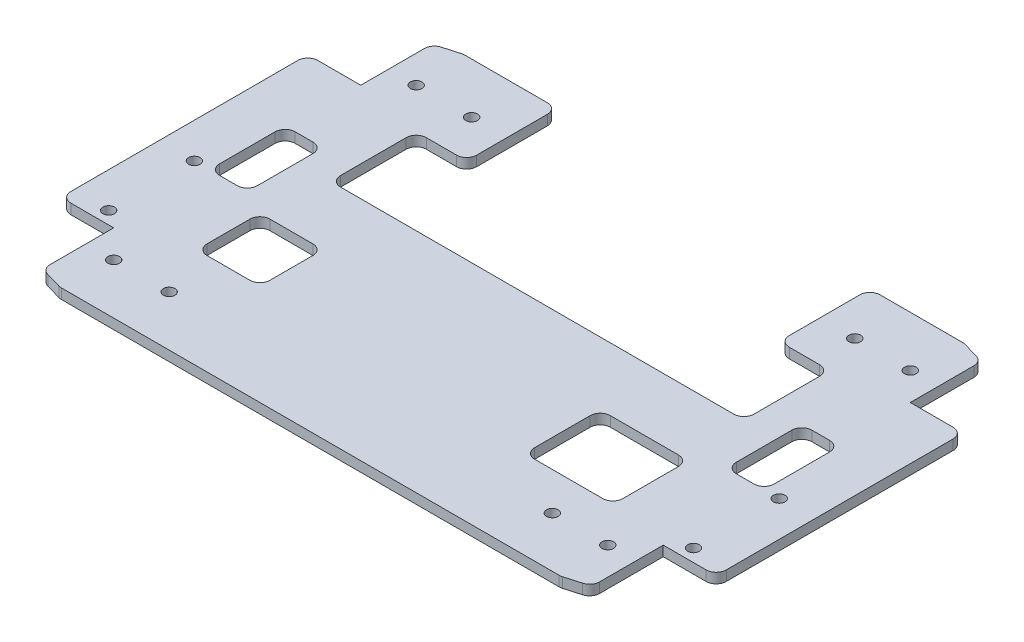
from build123d import *

# Parameters (mm, degrees)
BOSS_EXTRU_1_DEPTH       = 4
ENL_V_MAT_EXTRU_6_REACH  = 161.581
ESQUISSE15_R             = 2.3
ENL_V_MAT_EXTRU_10_REACH = 161.581
SYM_TRIE8_COPY_1_REACH   = 161.581
ENL_V_MAT_EXTRU_13_REACH = 161.581
ESQUISSE26_W             = 5
ESQUISSE26_H             = 98
ENL_V_MAT_EXTRU_14_REACH = 154.696
ESQUISSE27_R             = 2.3
ENL_V_MAT_EXTRU_15_REACH = 154.696
CONG_1_R                 = 4
ENL_V_MAT_EXTRU_16_REACH = 154.696
ESQUISSE29_W             = 35
ESQUISSE29_H             = 30
ESQUISSE29_W_2           = 15
ESQUISSE29_W_3           = 20
ESQUISSE29_H_2           = 34
ESQUISSE29_W_4           = 25
ESQUISSE29_H_3           = 25
CONG_2_R                 = 4
ENL_V_MAT_EXTRU_17_REACH = 154.696
ESQUISSE30_R             = 2.3
CONG_3_R                 = 4


with BuildPart() as part:
    # Esquisse1 → Boss.-Extru.1 (new body)
    with BuildSketch(Plane(origin=(0, 0, 0), x_dir=(1, 0, 0), z_dir=(0, 1, 0))):
        Polygon((-135, 0), (-135, -75), (-100, -85), (0, -85), (100, -85), (135, -75), (135, 0), (135, 75), (100, 85), (0, 85), (-100, 85), (-135, 75), align=None)
    extrude(amount=BOSS_EXTRU_1_DEPTH)

    # Esquisse15 → Enlèv. mat.-Extru.6 (cut, up to next)
    with BuildSketch(Plane(origin=(0, 4, 0), x_dir=(1, 0, 0), z_dir=(0, 1, 0)), mode=Mode.PRIVATE) as enl_v_mat_extru_6_sk1:
        with Locations(Location((-120, -60, 0), (0, 0, 270))):
            Circle(ESQUISSE15_R)
    enl_v_mat_extru_6_tool1 = extrude(enl_v_mat_extru_6_sk1.sketch, amount=-ENL_V_MAT_EXTRU_6_REACH, mode=Mode.PRIVATE) & part.part
    # Esquisse15 → Enlèv. mat.-Extru.6 (cut, up to next)
    with BuildSketch(Plane(origin=(0, 4, 0), x_dir=(1, 0, 0), z_dir=(0, 1, 0)), mode=Mode.PRIVATE) as enl_v_mat_extru_6_sk2:
        with Locations(Location((-120, 60, 0), (0, 0, 270))):
            Circle(ESQUISSE15_R)
    enl_v_mat_extru_6_tool2 = extrude(enl_v_mat_extru_6_sk2.sketch, amount=-ENL_V_MAT_EXTRU_6_REACH, mode=Mode.PRIVATE) & part.part
    enl_v_mat_extru_6_1 = enl_v_mat_extru_6_tool1.solids().sort_by_distance((-120, 4, 60))[0]
    add(enl_v_mat_extru_6_1, mode=Mode.SUBTRACT)
    enl_v_mat_extru_6_2 = enl_v_mat_extru_6_tool2.solids().sort_by_distance((-120, 4, -60))[0]
    add(enl_v_mat_extru_6_2, mode=Mode.SUBTRACT)
    enl_v_mat_extru_6 = enl_v_mat_extru_6_1 + enl_v_mat_extru_6_2  # Enlèv. mat.-Extru.6 as one shape, for the pattern or mirror that repeats it

    # Symétrie5: Enlèv. mat.-Extru.6 across plane
    add(enl_v_mat_extru_6.mirror(Plane(origin=(0, 0, 0), x_dir=(0, 0, 1), z_dir=(1, 0, 0))), mode=Mode.SUBTRACT)

    # Esquisse20 → Enlèv. mat.-Extru.10 (cut, up to next)
    with BuildSketch(Plane(origin=(0, 4, 0), x_dir=(1, 0, 0), z_dir=(0, 1, 0)), mode=Mode.PRIVATE) as enl_v_mat_extru_10_sk1:
        Polygon((-109, -60), (-109, -82.428571429), (-135, -75), (-135, -49), (-109, -49), align=None)
    enl_v_mat_extru_10_tool1 = extrude(enl_v_mat_extru_10_sk1.sketch, amount=-ENL_V_MAT_EXTRU_10_REACH, mode=Mode.PRIVATE) & part.part
    enl_v_mat_extru_10 = enl_v_mat_extru_10_tool1.solids().sort_by_distance((-121.458333, 4, 63.934524))[0]
    add(enl_v_mat_extru_10, mode=Mode.SUBTRACT)

    # Symétrie7: Enlèv. mat.-Extru.10 across plane
    add(enl_v_mat_extru_10.mirror(Plane(origin=(0, 0, 0), x_dir=(0, 0, 1), z_dir=(1, 0, 0))), mode=Mode.SUBTRACT)

    # Symétrie8: Enlèv. mat.-Extru.10 across plane
    add(enl_v_mat_extru_10.mirror(Plane.XY), mode=Mode.SUBTRACT)

    # Symétrie8 copy 1 sketch → Symétrie8 copy 1 (cut, up to next)
    with BuildSketch(Plane(origin=(0, 4, 0), x_dir=(-1, 0, 0), z_dir=(0, 1, 0)), mode=Mode.PRIVATE) as sym_trie8_copy_1_sk1:
        Polygon((-109, -60), (-109, -82.428571429), (-135, -75), (-135, -49), (-109, -49), align=None)
    sym_trie8_copy_1_tool1 = extrude(sym_trie8_copy_1_sk1.sketch, amount=-SYM_TRIE8_COPY_1_REACH, mode=Mode.PRIVATE) & part.part
    add(sym_trie8_copy_1_tool1.solids().sort_by_distance((121.458333, 4, -63.934524))[0], mode=Mode.SUBTRACT)

    # Esquisse26 → Enlèv. mat.-Extru.13 (cut, up to next)
    with BuildSketch(Plane(origin=(0, 4, 0), x_dir=(1, 0, 0), z_dir=(0, 1, 0)), mode=Mode.PRIVATE) as enl_v_mat_extru_13_sk1:
        Polygon((109, -82.428571429), (107.626394361, -77.62095169), (109, -77.228492936), align=None)
    enl_v_mat_extru_13_tool1 = extrude(enl_v_mat_extru_13_sk1.sketch, amount=-ENL_V_MAT_EXTRU_13_REACH, mode=Mode.PRIVATE) & part.part
    # Esquisse26 → Enlèv. mat.-Extru.13 (cut, up to next)
    with BuildSketch(Plane(origin=(0, 4, 0), x_dir=(1, 0, 0), z_dir=(0, 1, 0)), mode=Mode.PRIVATE) as enl_v_mat_extru_13_sk2:
        Polygon((100, -80), (100, -85), (109, -82.428571429), (107.626394361, -77.62095169), (99.299725277, -80), align=None)
    enl_v_mat_extru_13_tool2 = extrude(enl_v_mat_extru_13_sk2.sketch, amount=-ENL_V_MAT_EXTRU_13_REACH, mode=Mode.PRIVATE) & part.part
    # Esquisse26 → Enlèv. mat.-Extru.13 (cut, up to next)
    with BuildSketch(Plane(origin=(0, 4, 0), x_dir=(1, 0, 0), z_dir=(0, 1, 0)), mode=Mode.PRIVATE) as enl_v_mat_extru_13_sk3:
        Polygon((98.626394361, -80.192380262), (100, -85), (100, -80), (99.299725277, -80), align=None)
    enl_v_mat_extru_13_tool3 = extrude(enl_v_mat_extru_13_sk3.sketch, amount=-ENL_V_MAT_EXTRU_13_REACH, mode=Mode.PRIVATE) & part.part
    # Esquisse26 → Enlèv. mat.-Extru.13 (cut, up to next)
    with BuildSketch(Plane(origin=(0, 4, 0), x_dir=(1, 0, 0), z_dir=(0, 1, 0)), mode=Mode.PRIVATE) as enl_v_mat_extru_13_sk4:
        Polygon((-98.626394361, -80.192380262), (-100, -85), (100, -85), (98.626394361, -80.192380262), (99.299725277, -80), (-99.299725277, -80), align=None)
    enl_v_mat_extru_13_tool4 = extrude(enl_v_mat_extru_13_sk4.sketch, amount=-ENL_V_MAT_EXTRU_13_REACH, mode=Mode.PRIVATE) & part.part
    # Esquisse26 → Enlèv. mat.-Extru.13 (cut, up to next)
    with BuildSketch(Plane(origin=(0, 4, 0), x_dir=(1, 0, 0), z_dir=(0, 1, 0)), mode=Mode.PRIVATE) as enl_v_mat_extru_13_sk5:
        Polygon((-100, -80), (-100, -85), (-98.626394361, -80.192380262), (-99.299725277, -80), align=None)
    enl_v_mat_extru_13_tool5 = extrude(enl_v_mat_extru_13_sk5.sketch, amount=-ENL_V_MAT_EXTRU_13_REACH, mode=Mode.PRIVATE) & part.part
    # Esquisse26 → Enlèv. mat.-Extru.13 (cut, up to next)
    with BuildSketch(Plane(origin=(0, 4, 0), x_dir=(1, 0, 0), z_dir=(0, 1, 0)), mode=Mode.PRIVATE) as enl_v_mat_extru_13_sk6:
        Polygon((-107.626394361, -77.62095169), (-109, -82.428571429), (-100, -85), (-100, -80), (-99.299725277, -80), align=None)
    enl_v_mat_extru_13_tool6 = extrude(enl_v_mat_extru_13_sk6.sketch, amount=-ENL_V_MAT_EXTRU_13_REACH, mode=Mode.PRIVATE) & part.part
    # Esquisse26 → Enlèv. mat.-Extru.13 (cut, up to next)
    with BuildSketch(Plane(origin=(0, 4, 0), x_dir=(1, 0, 0), z_dir=(0, 1, 0)), mode=Mode.PRIVATE) as enl_v_mat_extru_13_sk7:
        Polygon((-107.626394361, -77.62095169), (-109, -77.228492936), (-109, -82.428571429), align=None)
    enl_v_mat_extru_13_tool7 = extrude(enl_v_mat_extru_13_sk7.sketch, amount=-ENL_V_MAT_EXTRU_13_REACH, mode=Mode.PRIVATE) & part.part
    # Esquisse26 → Enlèv. mat.-Extru.13 (cut, up to next)
    with BuildSketch(Plane(origin=(0, 4, 0), x_dir=(1, 0, 0), z_dir=(0, 1, 0)), mode=Mode.PRIVATE) as enl_v_mat_extru_13_sk8:
        with Locations((-132.5, 0)):
            Rectangle(ESQUISSE26_W, ESQUISSE26_H)
    enl_v_mat_extru_13_tool8 = extrude(enl_v_mat_extru_13_sk8.sketch, amount=-ENL_V_MAT_EXTRU_13_REACH, mode=Mode.PRIVATE) & part.part
    # Esquisse26 → Enlèv. mat.-Extru.13 (cut, up to next)
    with BuildSketch(Plane(origin=(0, 4, 0), x_dir=(1, 0, 0), z_dir=(0, 1, 0)), mode=Mode.PRIVATE) as enl_v_mat_extru_13_sk9:
        with Locations((132.5, 0)):
            Rectangle(ESQUISSE26_W, ESQUISSE26_H)
    enl_v_mat_extru_13_tool9 = extrude(enl_v_mat_extru_13_sk9.sketch, amount=-ENL_V_MAT_EXTRU_13_REACH, mode=Mode.PRIVATE) & part.part
    # Esquisse26 → Enlèv. mat.-Extru.13 (cut, up to next)
    with BuildSketch(Plane(origin=(0, 4, 0), x_dir=(1, 0, 0), z_dir=(0, 1, 0)), mode=Mode.PRIVATE) as enl_v_mat_extru_13_sk10:
        Polygon((107.626394361, 77.62095169), (109, 77.228492936), (109, 82.428571429), align=None)
    enl_v_mat_extru_13_tool10 = extrude(enl_v_mat_extru_13_sk10.sketch, amount=-ENL_V_MAT_EXTRU_13_REACH, mode=Mode.PRIVATE) & part.part
    # Esquisse26 → Enlèv. mat.-Extru.13 (cut, up to next)
    with BuildSketch(Plane(origin=(0, 4, 0), x_dir=(1, 0, 0), z_dir=(0, 1, 0)), mode=Mode.PRIVATE) as enl_v_mat_extru_13_sk11:
        Polygon((109, 82.428571429), (100, 85), (100, 80), (99.299725277, 80), (107.626394361, 77.62095169), align=None)
    enl_v_mat_extru_13_tool11 = extrude(enl_v_mat_extru_13_sk11.sketch, amount=-ENL_V_MAT_EXTRU_13_REACH, mode=Mode.PRIVATE) & part.part
    # Esquisse26 → Enlèv. mat.-Extru.13 (cut, up to next)
    with BuildSketch(Plane(origin=(0, 4, 0), x_dir=(1, 0, 0), z_dir=(0, 1, 0)), mode=Mode.PRIVATE) as enl_v_mat_extru_13_sk12:
        Polygon((100, 80), (100, 85), (98.626394361, 80.192380262), (99.299725277, 80), align=None)
    enl_v_mat_extru_13_tool12 = extrude(enl_v_mat_extru_13_sk12.sketch, amount=-ENL_V_MAT_EXTRU_13_REACH, mode=Mode.PRIVATE) & part.part
    # Esquisse26 → Enlèv. mat.-Extru.13 (cut, up to next)
    with BuildSketch(Plane(origin=(0, 4, 0), x_dir=(1, 0, 0), z_dir=(0, 1, 0)), mode=Mode.PRIVATE) as enl_v_mat_extru_13_sk13:
        Polygon((98.626394361, 80.192380262), (100, 85), (-100, 85), (-98.626394361, 80.192380262), (-99.299725277, 80), (99.299725277, 80), align=None)
    enl_v_mat_extru_13_tool13 = extrude(enl_v_mat_extru_13_sk13.sketch, amount=-ENL_V_MAT_EXTRU_13_REACH, mode=Mode.PRIVATE) & part.part
    # Esquisse26 → Enlèv. mat.-Extru.13 (cut, up to next)
    with BuildSketch(Plane(origin=(0, 4, 0), x_dir=(1, 0, 0), z_dir=(0, 1, 0)), mode=Mode.PRIVATE) as enl_v_mat_extru_13_sk14:
        Polygon((-98.626394361, 80.192380262), (-100, 85), (-100, 80), (-99.299725277, 80), align=None)
    enl_v_mat_extru_13_tool14 = extrude(enl_v_mat_extru_13_sk14.sketch, amount=-ENL_V_MAT_EXTRU_13_REACH, mode=Mode.PRIVATE) & part.part
    # Esquisse26 → Enlèv. mat.-Extru.13 (cut, up to next)
    with BuildSketch(Plane(origin=(0, 4, 0), x_dir=(1, 0, 0), z_dir=(0, 1, 0)), mode=Mode.PRIVATE) as enl_v_mat_extru_13_sk15:
        Polygon((-100, 80), (-100, 85), (-109, 82.428571429), (-107.626394361, 77.62095169), (-99.299725277, 80), align=None)
    enl_v_mat_extru_13_tool15 = extrude(enl_v_mat_extru_13_sk15.sketch, amount=-ENL_V_MAT_EXTRU_13_REACH, mode=Mode.PRIVATE) & part.part
    # Esquisse26 → Enlèv. mat.-Extru.13 (cut, up to next)
    with BuildSketch(Plane(origin=(0, 4, 0), x_dir=(1, 0, 0), z_dir=(0, 1, 0)), mode=Mode.PRIVATE) as enl_v_mat_extru_13_sk16:
        Polygon((-109, 82.428571429), (-107.626394361, 77.62095169), (-109, 77.228492936), align=None)
    enl_v_mat_extru_13_tool16 = extrude(enl_v_mat_extru_13_sk16.sketch, amount=-ENL_V_MAT_EXTRU_13_REACH, mode=Mode.PRIVATE) & part.part
    add(enl_v_mat_extru_13_tool1.solids().sort_by_distance((108.542131, 4, 79.092672))[0], mode=Mode.SUBTRACT)
    add(enl_v_mat_extru_13_tool2.solids().sort_by_distance((104.158937, 4, 81.27908))[0], mode=Mode.SUBTRACT)
    add(enl_v_mat_extru_13_tool3.solids().sort_by_distance((99.537641, 4, 81.69873))[0], mode=Mode.SUBTRACT)
    add(enl_v_mat_extru_13_tool4.solids().sort_by_distance((0, 4, 82.505651))[0], mode=Mode.SUBTRACT)
    add(enl_v_mat_extru_13_tool5.solids().sort_by_distance((-99.537641, 4, 81.69873))[0], mode=Mode.SUBTRACT)
    add(enl_v_mat_extru_13_tool6.solids().sort_by_distance((-104.158937, 4, 81.27908))[0], mode=Mode.SUBTRACT)
    add(enl_v_mat_extru_13_tool7.solids().sort_by_distance((-108.542131, 4, 79.092672))[0], mode=Mode.SUBTRACT)
    add(enl_v_mat_extru_13_tool8.solids().sort_by_distance((-132.5, 4, 0))[0], mode=Mode.SUBTRACT)
    add(enl_v_mat_extru_13_tool9.solids().sort_by_distance((132.5, 4, 0))[0], mode=Mode.SUBTRACT)
    add(enl_v_mat_extru_13_tool10.solids().sort_by_distance((108.542131, 4, -79.092672))[0], mode=Mode.SUBTRACT)
    add(enl_v_mat_extru_13_tool11.solids().sort_by_distance((104.158937, 4, -81.27908))[0], mode=Mode.SUBTRACT)
    add(enl_v_mat_extru_13_tool12.solids().sort_by_distance((99.537641, 4, -81.69873))[0], mode=Mode.SUBTRACT)
    add(enl_v_mat_extru_13_tool13.solids().sort_by_distance((0, 4, -82.505651))[0], mode=Mode.SUBTRACT)
    add(enl_v_mat_extru_13_tool14.solids().sort_by_distance((-99.537641, 4, -81.69873))[0], mode=Mode.SUBTRACT)
    add(enl_v_mat_extru_13_tool15.solids().sort_by_distance((-104.158937, 4, -81.27908))[0], mode=Mode.SUBTRACT)
    add(enl_v_mat_extru_13_tool16.solids().sort_by_distance((-108.542131, 4, -79.092672))[0], mode=Mode.SUBTRACT)

    # Esquisse27 → Enlèv. mat.-Extru.14 (cut, up to next)
    with BuildSketch(Plane(origin=(0, 4, 0), x_dir=(1, 0, 0), z_dir=(0, 1, 0)), mode=Mode.PRIVATE) as enl_v_mat_extru_14_sk1:
        with Locations(Location((-98, -60, 0), (0, 0, 270))):
            Circle(ESQUISSE27_R)
    enl_v_mat_extru_14_tool1 = extrude(enl_v_mat_extru_14_sk1.sketch, amount=-ENL_V_MAT_EXTRU_14_REACH, mode=Mode.PRIVATE) & part.part
    # Esquisse27 → Enlèv. mat.-Extru.14 (cut, up to next)
    with BuildSketch(Plane(origin=(0, 4, 0), x_dir=(1, 0, 0), z_dir=(0, 1, 0)), mode=Mode.PRIVATE) as enl_v_mat_extru_14_sk2:
        with Locations(Location((-76, -60, 0), (0, 0, 270))):
            Circle(ESQUISSE27_R)
    enl_v_mat_extru_14_tool2 = extrude(enl_v_mat_extru_14_sk2.sketch, amount=-ENL_V_MAT_EXTRU_14_REACH, mode=Mode.PRIVATE) & part.part
    # Esquisse27 → Enlèv. mat.-Extru.14 (cut, up to next)
    with BuildSketch(Plane(origin=(0, 4, 0), x_dir=(1, 0, 0), z_dir=(0, 1, 0)), mode=Mode.PRIVATE) as enl_v_mat_extru_14_sk3:
        with Locations(Location((76, -60, 0), (0, 0, 270))):
            Circle(ESQUISSE27_R)
    enl_v_mat_extru_14_tool3 = extrude(enl_v_mat_extru_14_sk3.sketch, amount=-ENL_V_MAT_EXTRU_14_REACH, mode=Mode.PRIVATE) & part.part
    # Esquisse27 → Enlèv. mat.-Extru.14 (cut, up to next)
    with BuildSketch(Plane(origin=(0, 4, 0), x_dir=(1, 0, 0), z_dir=(0, 1, 0)), mode=Mode.PRIVATE) as enl_v_mat_extru_14_sk4:
        with Locations(Location((98, -60, 0), (0, 0, 270))):
            Circle(ESQUISSE27_R)
    enl_v_mat_extru_14_tool4 = extrude(enl_v_mat_extru_14_sk4.sketch, amount=-ENL_V_MAT_EXTRU_14_REACH, mode=Mode.PRIVATE) & part.part
    # Esquisse27 → Enlèv. mat.-Extru.14 (cut, up to next)
    with BuildSketch(Plane(origin=(0, 4, 0), x_dir=(1, 0, 0), z_dir=(0, 1, 0)), mode=Mode.PRIVATE) as enl_v_mat_extru_14_sk5:
        with Locations(Location((98, 60, 0), (0, 0, 270))):
            Circle(ESQUISSE27_R)
    enl_v_mat_extru_14_tool5 = extrude(enl_v_mat_extru_14_sk5.sketch, amount=-ENL_V_MAT_EXTRU_14_REACH, mode=Mode.PRIVATE) & part.part
    # Esquisse27 → Enlèv. mat.-Extru.14 (cut, up to next)
    with BuildSketch(Plane(origin=(0, 4, 0), x_dir=(1, 0, 0), z_dir=(0, 1, 0)), mode=Mode.PRIVATE) as enl_v_mat_extru_14_sk6:
        with Locations(Location((76, 60, 0), (0, 0, 270))):
            Circle(ESQUISSE27_R)
    enl_v_mat_extru_14_tool6 = extrude(enl_v_mat_extru_14_sk6.sketch, amount=-ENL_V_MAT_EXTRU_14_REACH, mode=Mode.PRIVATE) & part.part
    # Esquisse27 → Enlèv. mat.-Extru.14 (cut, up to next)
    with BuildSketch(Plane(origin=(0, 4, 0), x_dir=(1, 0, 0), z_dir=(0, 1, 0)), mode=Mode.PRIVATE) as enl_v_mat_extru_14_sk7:
        with Locations(Location((-76, 60, 0), (0, 0, 270))):
            Circle(ESQUISSE27_R)
    enl_v_mat_extru_14_tool7 = extrude(enl_v_mat_extru_14_sk7.sketch, amount=-ENL_V_MAT_EXTRU_14_REACH, mode=Mode.PRIVATE) & part.part
    # Esquisse27 → Enlèv. mat.-Extru.14 (cut, up to next)
    with BuildSketch(Plane(origin=(0, 4, 0), x_dir=(1, 0, 0), z_dir=(0, 1, 0)), mode=Mode.PRIVATE) as enl_v_mat_extru_14_sk8:
        with Locations(Location((-98, 60, 0), (0, 0, 270))):
            Circle(ESQUISSE27_R)
    enl_v_mat_extru_14_tool8 = extrude(enl_v_mat_extru_14_sk8.sketch, amount=-ENL_V_MAT_EXTRU_14_REACH, mode=Mode.PRIVATE) & part.part
    add(enl_v_mat_extru_14_tool1.solids().sort_by_distance((-98, 4, 60))[0], mode=Mode.SUBTRACT)
    add(enl_v_mat_extru_14_tool2.solids().sort_by_distance((-76, 4, 60))[0], mode=Mode.SUBTRACT)
    add(enl_v_mat_extru_14_tool3.solids().sort_by_distance((76, 4, 60))[0], mode=Mode.SUBTRACT)
    add(enl_v_mat_extru_14_tool4.solids().sort_by_distance((98, 4, 60))[0], mode=Mode.SUBTRACT)
    add(enl_v_mat_extru_14_tool5.solids().sort_by_distance((98, 4, -60))[0], mode=Mode.SUBTRACT)
    add(enl_v_mat_extru_14_tool6.solids().sort_by_distance((76, 4, -60))[0], mode=Mode.SUBTRACT)
    add(enl_v_mat_extru_14_tool7.solids().sort_by_distance((-76, 4, -60))[0], mode=Mode.SUBTRACT)
    add(enl_v_mat_extru_14_tool8.solids().sort_by_distance((-98, 4, -60))[0], mode=Mode.SUBTRACT)

    # Esquisse28 → Enlèv. mat.-Extru.15 (cut, up to next)
    with BuildSketch(Plane(origin=(0, 4, 0), x_dir=(1, 0, 0), z_dir=(0, 1, 0)), mode=Mode.PRIVATE) as enl_v_mat_extru_15_sk1:
        Polygon((0, 80), (-62, 80), (-62, 10), (0, 10), (62, 10), (62, 80), align=None)
    enl_v_mat_extru_15_tool1 = extrude(enl_v_mat_extru_15_sk1.sketch, amount=-ENL_V_MAT_EXTRU_15_REACH, mode=Mode.PRIVATE) & part.part
    add(enl_v_mat_extru_15_tool1.solids().sort_by_distance((0, 4, -45))[0], mode=Mode.SUBTRACT)

    # Congé1
    cong_1_edges = [part.edges().sort_by_distance(p)[0] for p in [
        (62, 2, -80),
        (-62, 2, -80),
    ]]
    fillet(cong_1_edges, radius=CONG_1_R)

    # Esquisse29 → Enlèv. mat.-Extru.16 (cut, up to next)
    with BuildSketch(Plane(origin=(0, 4, 0), x_dir=(1, 0, 0), z_dir=(0, 1, 0)), mode=Mode.PRIVATE) as enl_v_mat_extru_16_sk1:
        with Locations((67.5, -30)):
            Rectangle(ESQUISSE29_W, ESQUISSE29_H)
    enl_v_mat_extru_16_tool1 = extrude(enl_v_mat_extru_16_sk1.sketch, amount=-ENL_V_MAT_EXTRU_16_REACH, mode=Mode.PRIVATE) & part.part
    # Esquisse29 → Enlèv. mat.-Extru.16 (cut, up to next)
    with BuildSketch(Plane(origin=(0, 4, 0), x_dir=(1, 0, 0), z_dir=(0, 1, 0)), mode=Mode.PRIVATE) as enl_v_mat_extru_16_sk2:
        with Locations((102.5, 5)):
            Rectangle(ESQUISSE29_W_2, ESQUISSE29_H)
    enl_v_mat_extru_16_tool2 = extrude(enl_v_mat_extru_16_sk2.sketch, amount=-ENL_V_MAT_EXTRU_16_REACH, mode=Mode.PRIVATE) & part.part
    # Esquisse29 → Enlèv. mat.-Extru.16 (cut, up to next)
    with BuildSketch(Plane(origin=(0, 4, 0), x_dir=(1, 0, 0), z_dir=(0, 1, 0)), mode=Mode.PRIVATE) as enl_v_mat_extru_16_sk3:
        with Locations((-102.5, 5)):
            Rectangle(ESQUISSE29_W_2, ESQUISSE29_H)
    enl_v_mat_extru_16_tool3 = extrude(enl_v_mat_extru_16_sk3.sketch, amount=-ENL_V_MAT_EXTRU_16_REACH, mode=Mode.PRIVATE) & part.part
    # Esquisse29 → Enlèv. mat.-Extru.16 (cut, up to next)
    with BuildSketch(Plane(origin=(0, 4, 0), x_dir=(1, 0, 0), z_dir=(0, 1, 0)), mode=Mode.PRIVATE) as enl_v_mat_extru_16_sk4:
        with Locations((-72, 27)):
            Rectangle(ESQUISSE29_W_3, ESQUISSE29_H_2)
    enl_v_mat_extru_16_tool4 = extrude(enl_v_mat_extru_16_sk4.sketch, amount=-ENL_V_MAT_EXTRU_16_REACH, mode=Mode.PRIVATE) & part.part
    # Esquisse29 → Enlèv. mat.-Extru.16 (cut, up to next)
    with BuildSketch(Plane(origin=(0, 4, 0), x_dir=(1, 0, 0), z_dir=(0, 1, 0)), mode=Mode.PRIVATE) as enl_v_mat_extru_16_sk5:
        with Locations((72, 27)):
            Rectangle(ESQUISSE29_W_3, ESQUISSE29_H_2)
    enl_v_mat_extru_16_tool5 = extrude(enl_v_mat_extru_16_sk5.sketch, amount=-ENL_V_MAT_EXTRU_16_REACH, mode=Mode.PRIVATE) & part.part
    # Esquisse29 → Enlèv. mat.-Extru.16 (cut, up to next)
    with BuildSketch(Plane(origin=(0, 4, 0), x_dir=(1, 0, 0), z_dir=(0, 1, 0)), mode=Mode.PRIVATE) as enl_v_mat_extru_16_sk6:
        with Locations((-72.5, -27.5)):
            Rectangle(ESQUISSE29_W_4, ESQUISSE29_H_3)
    enl_v_mat_extru_16_tool6 = extrude(enl_v_mat_extru_16_sk6.sketch, amount=-ENL_V_MAT_EXTRU_16_REACH, mode=Mode.PRIVATE) & part.part
    add(enl_v_mat_extru_16_tool1.solids().sort_by_distance((67.5, 4, 30))[0], mode=Mode.SUBTRACT)
    add(enl_v_mat_extru_16_tool2.solids().sort_by_distance((102.5, 4, -5))[0], mode=Mode.SUBTRACT)
    add(enl_v_mat_extru_16_tool3.solids().sort_by_distance((-102.5, 4, -5))[0], mode=Mode.SUBTRACT)
    add(enl_v_mat_extru_16_tool4.solids().sort_by_distance((-72, 4, -27))[0], mode=Mode.SUBTRACT)
    add(enl_v_mat_extru_16_tool5.solids().sort_by_distance((72, 4, -27))[0], mode=Mode.SUBTRACT)
    add(enl_v_mat_extru_16_tool6.solids().sort_by_distance((-72.5, 4, 27.5))[0], mode=Mode.SUBTRACT)

    # Congé2
    cong_2_edges = [part.edges().sort_by_distance(p)[0] for p in [
        (-85, 2, 40),
        (-85, 2, 15),
        (-60, 2, 15),
        (-60, 2, 40),
        (95, 2, -20),
        (110, 2, -20),
        (110, 2, 10),
        (95, 2, 10),
        (82, 2, -44),
        (82, 2, -10),
        (62, 2, -44),
        (-82, 2, -10),
        (-82, 2, -44),
        (-62, 2, -44),
        (-110, 2, 10),
        (-110, 2, -20),
        (-95, 2, -20),
        (-95, 2, 10),
        (50, 2, 15),
        (85, 2, 15),
        (85, 2, 45),
        (50, 2, 45),
    ]]
    fillet(cong_2_edges, radius=CONG_2_R)

    # Esquisse30 → Enlèv. mat.-Extru.17 (cut, up to next)
    with BuildSketch(Plane(origin=(0, 4, 0), x_dir=(1, 0, 0), z_dir=(0, 1, 0)), mode=Mode.PRIVATE) as enl_v_mat_extru_17_sk1:
        with Locations(Location((-116, -44, 0), (0, 0, 270))):
            Circle(ESQUISSE30_R)
    enl_v_mat_extru_17_tool1 = extrude(enl_v_mat_extru_17_sk1.sketch, amount=-ENL_V_MAT_EXTRU_17_REACH, mode=Mode.PRIVATE) & part.part
    # Esquisse30 → Enlèv. mat.-Extru.17 (cut, up to next)
    with BuildSketch(Plane(origin=(0, 4, 0), x_dir=(1, 0, 0), z_dir=(0, 1, 0)), mode=Mode.PRIVATE) as enl_v_mat_extru_17_sk2:
        with Locations(Location((-116, -10, 0), (0, 0, 270))):
            Circle(ESQUISSE30_R)
    enl_v_mat_extru_17_tool2 = extrude(enl_v_mat_extru_17_sk2.sketch, amount=-ENL_V_MAT_EXTRU_17_REACH, mode=Mode.PRIVATE) & part.part
    # Esquisse30 → Enlèv. mat.-Extru.17 (cut, up to next)
    with BuildSketch(Plane(origin=(0, 4, 0), x_dir=(1, 0, 0), z_dir=(0, 1, 0)), mode=Mode.PRIVATE) as enl_v_mat_extru_17_sk3:
        with Locations(Location((116, -44, 0), (0, 0, 270))):
            Circle(ESQUISSE30_R)
    enl_v_mat_extru_17_tool3 = extrude(enl_v_mat_extru_17_sk3.sketch, amount=-ENL_V_MAT_EXTRU_17_REACH, mode=Mode.PRIVATE) & part.part
    # Esquisse30 → Enlèv. mat.-Extru.17 (cut, up to next)
    with BuildSketch(Plane(origin=(0, 4, 0), x_dir=(1, 0, 0), z_dir=(0, 1, 0)), mode=Mode.PRIVATE) as enl_v_mat_extru_17_sk4:
        with Locations(Location((116, -10, 0), (0, 0, 270))):
            Circle(ESQUISSE30_R)
    enl_v_mat_extru_17_tool4 = extrude(enl_v_mat_extru_17_sk4.sketch, amount=-ENL_V_MAT_EXTRU_17_REACH, mode=Mode.PRIVATE) & part.part
    add(enl_v_mat_extru_17_tool1.solids().sort_by_distance((-116, 4, 44))[0], mode=Mode.SUBTRACT)
    add(enl_v_mat_extru_17_tool2.solids().sort_by_distance((-116, 4, 10))[0], mode=Mode.SUBTRACT)
    add(enl_v_mat_extru_17_tool3.solids().sort_by_distance((116, 4, 44))[0], mode=Mode.SUBTRACT)
    add(enl_v_mat_extru_17_tool4.solids().sort_by_distance((116, 4, 10))[0], mode=Mode.SUBTRACT)

    # Congé3
    cong_3_edges = [part.edges().sort_by_distance(p)[0] for p in [
        (-99.299725277, 2, 80),
        (99.299725277, 2, 80),
        (109, 2, 77.228492936),
        (-109, 2, 77.228492936),
        (-130, 2, 49),
        (-130, 2, -49),
        (130, 2, 49),
        (130, 2, -49),
        (109, 2, -77.228492936),
        (99.299725277, 2, -80),
        (-99.299725277, 2, -80),
        (-109, 2, -77.228492936),
    ]]
    fillet(cong_3_edges, radius=CONG_3_R)


solid = part.part
